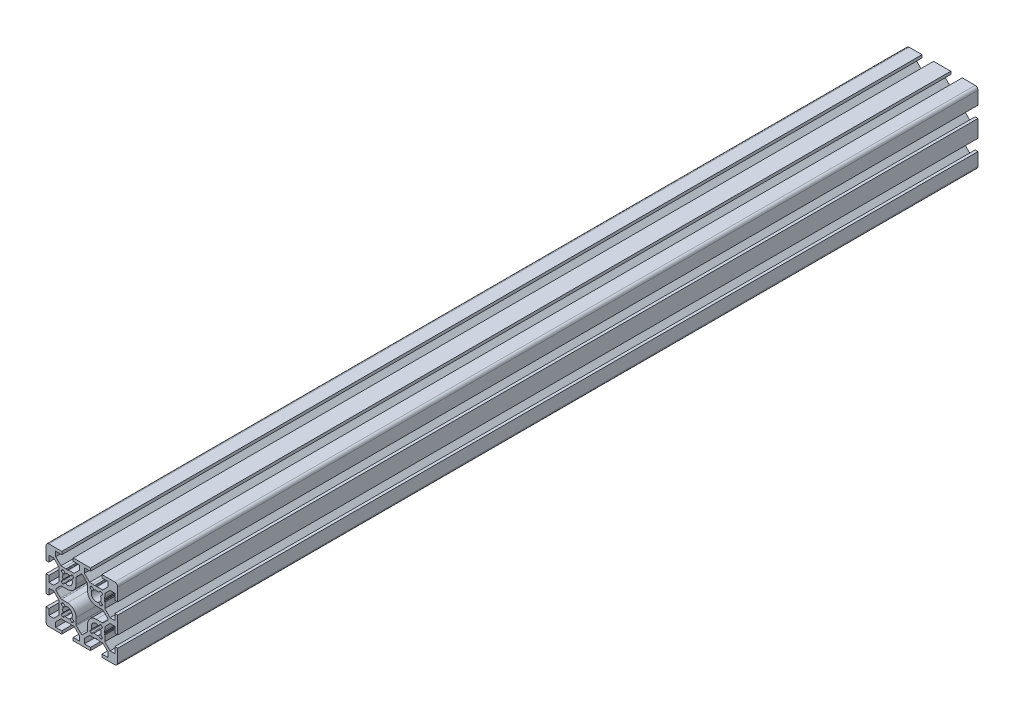
from build123d import *

# Parameters (mm, degrees)
BOSS_EXTRUDE1_DEPTH = 600
CUT_EXTRUDE1_DEPTH  = 602.040764009
CUT_EXTRUDE2_DEPTH  = 602.040764009
CUT_EXTRUDE3_DEPTH  = 602.040764009
CUT_EXTRUDE4_DEPTH  = 602.040764009


with BuildPart() as part:
    # Sketch1 → Boss-Extrude1 (new body)
    with BuildSketch(Plane.XY):
        with BuildLine():
            Line((-25, 23), (-25, 14))
            Line((-25, 14), (-23, 14))
            Line((-23, 14), (-23, 18.25))
            Line((-23, 18.25), (-19.664213562, 18.25))
            Line((-19.664213562, 18.25), (-16, 14.585786438))
            Line((-16, 14.585786438), (-16, 10.653589838))
            ThreePointArc((-16, 10.653589838), (-15.982962913, 10.524180316), (-15.933012702, 10.403589838))
            Line((-15.933012702, 10.403589838), (-15.7, 10))
            Line((-15.7, 10), (-15.933012702, 9.596410162))
            ThreePointArc((-15.933012702, 9.596410162), (-16, 9.346410162), (-15.933012702, 9.096410162))
            Line((-15.933012702, 9.096410162), (-15.750976592, 8.781114371))
            Line((-15.750976592, 8.781114371), (-16, 7.5))
            Line((-16, 7.5), (-16, 5.414213562))
            Line((-16, 5.414213562), (-19.664213562, 1.75))
            Line((-19.664213562, 1.75), (-23, 1.75))
            Line((-23, 1.75), (-23, 6))
            Line((-23, 6), (-25, 6))
            Line((-25, 6), (-25, -6))
            Line((-25, -6), (-23, -6))
            Line((-23, -6), (-23, -1.75))
            Line((-23, -1.75), (-19.664213562, -1.75))
            Line((-19.664213562, -1.75), (-16, -5.414213562))
            Line((-16, -5.414213562), (-16, -9.346410162))
            ThreePointArc((-16, -9.346410162), (-15.982962913, -9.475819684), (-15.933012702, -9.596410162))
            Line((-15.933012702, -9.596410162), (-15.7, -10))
            Line((-15.7, -10), (-15.933012702, -10.403589838))
            ThreePointArc((-15.933012702, -10.403589838), (-16, -10.653589838), (-15.933012702, -10.903589838))
            Line((-15.933012702, -10.903589838), (-15.750976592, -11.218885629))
            Line((-15.750976592, -11.218885629), (-16, -12.5))
            Line((-16, -12.5), (-16, -14.585786438))
            Line((-16, -14.585786438), (-19.664213562, -18.25))
            Line((-19.664213562, -18.25), (-23, -18.25))
            Line((-23, -18.25), (-23, -14))
            Line((-23, -14), (-25, -14))
            Line((-25, -14), (-25, -23))
            ThreePointArc((-25, -23), (-24.414213562, -24.414213562), (-23, -25))
            Line((-23, -25), (-14, -25))
            Line((-14, -25), (-14, -23))
            Line((-14, -23), (-18.25, -23))
            Line((-18.25, -23), (-18.25, -19.664213562))
            Line((-18.25, -19.664213562), (-14.585786438, -16))
            Line((-14.585786438, -16), (-10.653589838, -16))
            ThreePointArc((-10.653589838, -16), (-10.524180316, -15.982962913), (-10.403589838, -15.933012702))
            Line((-10.403589838, -15.933012702), (-10, -15.7))
            Line((-10, -15.7), (-9.596410162, -15.933012702))
            ThreePointArc((-9.596410162, -15.933012702), (-9.346410162, -16), (-9.096410162, -15.933012702))
            Line((-9.096410162, -15.933012702), (-8.781114371, -15.750976592))
            Line((-8.781114371, -15.750976592), (-7.5, -16))
            Line((-7.5, -16), (-5.414213562, -16))
            Line((-5.414213562, -16), (-1.75, -19.664213562))
            Line((-1.75, -19.664213562), (-1.75, -23))
            Line((-1.75, -23), (-6, -23))
            Line((-6, -23), (-6, -25))
            Line((-6, -25), (6, -25))
            Line((6, -25), (6, -23))
            Line((6, -23), (1.75, -23))
            Line((1.75, -23), (1.75, -19.664213562))
            Line((1.75, -19.664213562), (5.414213562, -16))
            Line((5.414213562, -16), (9.346410162, -16))
            ThreePointArc((9.346410162, -16), (9.475819684, -15.982962913), (9.596410162, -15.933012702))
            Line((9.596410162, -15.933012702), (10, -15.7))
            Line((10, -15.7), (10.403589838, -15.933012702))
            ThreePointArc((10.403589838, -15.933012702), (10.653589838, -16), (10.903589838, -15.933012702))
            Line((10.903589838, -15.933012702), (11.218885629, -15.750976592))
            Line((11.218885629, -15.750976592), (12.5, -16))
            Line((12.5, -16), (14.585786438, -16))
            Line((14.585786438, -16), (18.25, -19.664213562))
            Line((18.25, -19.664213562), (18.25, -23))
            Line((18.25, -23), (14, -23))
            Line((14, -23), (14, -25))
            Line((14, -25), (23, -25))
            ThreePointArc((23, -25), (24.414213562, -24.414213562), (25, -23))
            Line((25, -23), (25, -14))
            Line((25, -14), (23, -14))
            Line((23, -14), (23, -18.25))
            Line((23, -18.25), (19.664213562, -18.25))
            Line((19.664213562, -18.25), (16, -14.585786438))
            Line((16, -14.585786438), (16, -10.653589838))
            ThreePointArc((16, -10.653589838), (15.982962913, -10.524180316), (15.933012702, -10.403589838))
            Line((15.933012702, -10.403589838), (15.7, -10))
            Line((15.7, -10), (15.933012702, -9.596410162))
            ThreePointArc((15.933012702, -9.596410162), (16, -9.346410162), (15.933012702, -9.096410162))
            Line((15.933012702, -9.096410162), (15.750976592, -8.781114371))
            Line((15.750976592, -8.781114371), (16, -7.5))
            Line((16, -7.5), (16, -5.414213562))
            Line((16, -5.414213562), (19.664213562, -1.75))
            Line((19.664213562, -1.75), (23, -1.75))
            Line((23, -1.75), (23, -6))
            Line((23, -6), (25, -6))
            Line((25, -6), (25, 6))
            Line((25, 6), (23, 6))
            Line((23, 6), (23, 1.75))
            Line((23, 1.75), (19.664213562, 1.75))
            Line((19.664213562, 1.75), (16, 5.414213562))
            Line((16, 5.414213562), (16, 9.346410162))
            ThreePointArc((16, 9.346410162), (15.982962913, 9.475819684), (15.933012702, 9.596410162))
            Line((15.933012702, 9.596410162), (15.7, 10))
            Line((15.7, 10), (15.933012702, 10.403589838))
            ThreePointArc((15.933012702, 10.403589838), (16, 10.653589838), (15.933012702, 10.903589838))
            Line((15.933012702, 10.903589838), (15.750976592, 11.218885629))
            Line((15.750976592, 11.218885629), (16, 12.5))
            Line((16, 12.5), (16, 14.585786438))
            Line((16, 14.585786438), (19.664213562, 18.25))
            Line((19.664213562, 18.25), (23, 18.25))
            Line((23, 18.25), (23, 14))
            Line((23, 14), (25, 14))
            Line((25, 14), (25, 23))
            ThreePointArc((25, 23), (24.414213562, 24.414213562), (23, 25))
            Line((23, 25), (14, 25))
            Line((14, 25), (14, 23))
            Line((14, 23), (18.25, 23))
            Line((18.25, 23), (18.25, 19.664213562))
            Line((18.25, 19.664213562), (14.585786438, 16))
            Line((14.585786438, 16), (10.653589838, 16))
            ThreePointArc((10.653589838, 16), (10.524180316, 15.982962913), (10.403589838, 15.933012702))
            Line((10.403589838, 15.933012702), (10, 15.7))
            Line((10, 15.7), (9.596410162, 15.933012702))
            ThreePointArc((9.596410162, 15.933012702), (9.346410162, 16), (9.096410162, 15.933012702))
            Line((9.096410162, 15.933012702), (8.781114371, 15.750976592))
            Line((8.781114371, 15.750976592), (7.5, 16))
            Line((7.5, 16), (5.414213562, 16))
            Line((5.414213562, 16), (1.75, 19.664213562))
            Line((1.75, 19.664213562), (1.75, 23))
            Line((1.75, 23), (6, 23))
            Line((6, 23), (6, 25))
            Line((6, 25), (-6, 25))
            Line((-6, 25), (-6, 23))
            Line((-6, 23), (-1.75, 23))
            Line((-1.75, 23), (-1.75, 19.664213562))
            Line((-1.75, 19.664213562), (-5.414213562, 16))
            Line((-5.414213562, 16), (-9.346410162, 16))
            ThreePointArc((-9.346410162, 16), (-9.475819684, 15.982962913), (-9.596410162, 15.933012702))
            Line((-9.596410162, 15.933012702), (-10, 15.7))
            Line((-10, 15.7), (-10.403589838, 15.933012702))
            ThreePointArc((-10.403589838, 15.933012702), (-10.653589838, 16), (-10.903589838, 15.933012702))
            Line((-10.903589838, 15.933012702), (-11.218885629, 15.750976592))
            Line((-11.218885629, 15.750976592), (-12.5, 16))
            Line((-12.5, 16), (-14.585786438, 16))
            Line((-14.585786438, 16), (-18.25, 19.664213562))
            Line((-18.25, 19.664213562), (-18.25, 23))
            Line((-18.25, 23), (-14, 23))
            Line((-14, 23), (-14, 25))
            Line((-14, 25), (-23, 25))
            ThreePointArc((-23, 25), (-24.414213562, 24.414213562), (-25, 23))
        make_face()
        with BuildLine():
            Line((-17.878679656, -0.707106781), (-14.878679656, -3.707106781))
            ThreePointArc((-14.878679656, -3.707106781), (-14.554256308, -3.923879533), (-14.171572875, -4))
            Line((-14.171572875, -4), (-10, -4))
            ThreePointArc((-10, -4), (-5.757359313, -5.757359313), (-4, -10))
            Line((-4, -10), (-4, -14.171572875))
            ThreePointArc((-4, -14.171572875), (-3.923879533, -14.554256308), (-3.707106781, -14.878679656))
            Line((-3.707106781, -14.878679656), (-0.707106781, -17.878679656))
            ThreePointArc((-0.707106781, -17.878679656), (0, -18.171572875), (0.707106781, -17.878679656))
            Line((0.707106781, -17.878679656), (3.707106781, -14.878679656))
            ThreePointArc((3.707106781, -14.878679656), (3.923879533, -14.554256308), (4, -14.171572875))
            Line((4, -14.171572875), (4, -10))
            ThreePointArc((4, -10), (5.757359313, -5.757359313), (10, -4))
            Line((10, -4), (14.171572875, -4))
            ThreePointArc((14.171572875, -4), (14.554256308, -3.923879533), (14.878679656, -3.707106781))
            Line((14.878679656, -3.707106781), (17.878679656, -0.707106781))
            ThreePointArc((17.878679656, -0.707106781), (18.171572875, 0), (17.878679656, 0.707106781))
            Line((17.878679656, 0.707106781), (14.878679656, 3.707106781))
            ThreePointArc((14.878679656, 3.707106781), (14.554256308, 3.923879533), (14.171572875, 4))
            Line((14.171572875, 4), (10, 4))
            ThreePointArc((10, 4), (5.757359313, 5.757359313), (4, 10))
            Line((4, 10), (4, 14.171572875))
            ThreePointArc((4, 14.171572875), (3.923879533, 14.554256308), (3.707106781, 14.878679656))
            Line((3.707106781, 14.878679656), (0.707106781, 17.878679656))
            ThreePointArc((0.707106781, 17.878679656), (0, 18.171572875), (-0.707106781, 17.878679656))
            Line((-0.707106781, 17.878679656), (-3.707106781, 14.878679656))
            ThreePointArc((-3.707106781, 14.878679656), (-3.923879533, 14.554256308), (-4, 14.171572875))
            Line((-4, 14.171572875), (-4, 10))
            ThreePointArc((-4, 10), (-5.757359313, 5.757359313), (-10, 4))
            Line((-10, 4), (-14.171572875, 4))
            ThreePointArc((-14.171572875, 4), (-14.554256308, 3.923879533), (-14.878679656, 3.707106781))
            Line((-14.878679656, 3.707106781), (-17.878679656, 0.707106781))
            ThreePointArc((-17.878679656, 0.707106781), (-18.171572875, 0), (-17.878679656, -0.707106781))
        make_face(mode=Mode.SUBTRACT)
    extrude(amount=-BOSS_EXTRUDE1_DEPTH)

    # Sketch2 → Cut-Extrude1 (cut, through all)
    with BuildSketch(Plane.XY):
        with BuildLine():
            Line((-14.242640687, 12.828427125), (-13.205105981, 11.790892418))
            ThreePointArc((-13.205105981, 11.790892418), (-13.095045749, 11.583064884), (-13.120796199, 11.349307631))
            ThreePointArc((-13.120796199, 11.349307631), (-13.4, 10.000000021), (-13.120796216, 8.650692407))
            ThreePointArc((-13.120796216, 8.650692407), (-13.095045745, 8.416935137), (-13.205105981, 8.209107582))
            Line((-13.205105981, 8.209107582), (-14.242640687, 7.171572875))
            ThreePointArc((-14.242640687, 7.171572875), (-14.389087297, 6.818019485), (-14.242640687, 6.464466094))
            Line((-14.242640687, 6.464466094), (-13.535533906, 5.757359313))
            ThreePointArc((-13.535533906, 5.757359313), (-13.181980515, 5.610912703), (-12.828427125, 5.757359313))
            Line((-12.828427125, 5.757359313), (-11.790892418, 6.794894019))
            ThreePointArc((-11.790892418, 6.794894019), (-11.583064884, 6.904954251), (-11.349307631, 6.879203801))
            ThreePointArc((-11.349307631, 6.879203801), (-7.595836944, 7.595836944), (-6.879203801, 11.349307631))
            ThreePointArc((-6.879203801, 11.349307631), (-6.904954251, 11.583064884), (-6.794894019, 11.790892418))
            Line((-6.794894019, 11.790892418), (-5.757359313, 12.828427125))
            ThreePointArc((-5.757359313, 12.828427125), (-5.610912703, 13.181980515), (-5.757359313, 13.535533906))
            Line((-5.757359313, 13.535533906), (-6.464466094, 14.242640687))
            ThreePointArc((-6.464466094, 14.242640687), (-6.818019485, 14.389087297), (-7.171572875, 14.242640687))
            Line((-7.171572875, 14.242640687), (-8.209107582, 13.205105981))
            ThreePointArc((-8.209107582, 13.205105981), (-8.416935116, 13.095045749), (-8.650692369, 13.120796199))
            ThreePointArc((-8.650692369, 13.120796199), (-9.999999979, 13.4), (-11.349307593, 13.120796216))
            ThreePointArc((-11.349307593, 13.120796216), (-11.583064863, 13.095045745), (-11.790892418, 13.205105981))
            Line((-11.790892418, 13.205105981), (-12.828427125, 14.242640687))
            ThreePointArc((-12.828427125, 14.242640687), (-13.181980515, 14.389087297), (-13.535533906, 14.242640687))
            Line((-13.535533906, 14.242640687), (-14.242640687, 13.535533906))
            ThreePointArc((-14.242640687, 13.535533906), (-14.389087297, 13.181980515), (-14.242640687, 12.828427125))
        make_face()
    extrude(amount=-CUT_EXTRUDE1_DEPTH, mode=Mode.SUBTRACT)

    # Sketch3 → Cut-Extrude2 (cut, through all)
    with BuildSketch(Plane.XY):
        with BuildLine():
            Line((-12.828427125, -14.242640687), (-11.790892418, -13.205105981))
            ThreePointArc((-11.790892418, -13.205105981), (-11.583064884, -13.095045749), (-11.349307631, -13.120796199))
            ThreePointArc((-11.349307631, -13.120796199), (-10.000000021, -13.4), (-8.650692407, -13.120796216))
            ThreePointArc((-8.650692407, -13.120796216), (-8.416935137, -13.095045745), (-8.209107582, -13.205105981))
            Line((-8.209107582, -13.205105981), (-7.171572875, -14.242640687))
            ThreePointArc((-7.171572875, -14.242640687), (-6.818019485, -14.389087297), (-6.464466094, -14.242640687))
            Line((-6.464466094, -14.242640687), (-5.757359313, -13.535533906))
            ThreePointArc((-5.757359313, -13.535533906), (-5.610912703, -13.181980515), (-5.757359313, -12.828427125))
            Line((-5.757359313, -12.828427125), (-6.794894019, -11.790892418))
            ThreePointArc((-6.794894019, -11.790892418), (-6.904954251, -11.583064884), (-6.879203801, -11.349307631))
            ThreePointArc((-6.879203801, -11.349307631), (-7.595836944, -7.595836944), (-11.349307631, -6.879203801))
            ThreePointArc((-11.349307631, -6.879203801), (-11.583064884, -6.904954251), (-11.790892418, -6.794894019))
            Line((-11.790892418, -6.794894019), (-12.828427125, -5.757359313))
            ThreePointArc((-12.828427125, -5.757359313), (-13.181980515, -5.610912703), (-13.535533906, -5.757359313))
            Line((-13.535533906, -5.757359313), (-14.242640687, -6.464466094))
            ThreePointArc((-14.242640687, -6.464466094), (-14.389087297, -6.818019485), (-14.242640687, -7.171572875))
            Line((-14.242640687, -7.171572875), (-13.205105981, -8.209107582))
            ThreePointArc((-13.205105981, -8.209107582), (-13.095045749, -8.416935116), (-13.120796199, -8.650692369))
            ThreePointArc((-13.120796199, -8.650692369), (-13.4, -9.999999979), (-13.120796216, -11.349307593))
            ThreePointArc((-13.120796216, -11.349307593), (-13.095045745, -11.583064863), (-13.205105981, -11.790892418))
            Line((-13.205105981, -11.790892418), (-14.242640687, -12.828427125))
            ThreePointArc((-14.242640687, -12.828427125), (-14.389087297, -13.181980515), (-14.242640687, -13.535533906))
            Line((-14.242640687, -13.535533906), (-13.535533906, -14.242640687))
            ThreePointArc((-13.535533906, -14.242640687), (-13.181980515, -14.389087297), (-12.828427125, -14.242640687))
        make_face()
    extrude(amount=-CUT_EXTRUDE2_DEPTH, mode=Mode.SUBTRACT)

    # Sketch4 → Cut-Extrude3 (cut, through all)
    with BuildSketch(Plane.XY):
        with BuildLine():
            Line((14.242640687, -12.828427125), (13.205105981, -11.790892418))
            ThreePointArc((13.205105981, -11.790892418), (13.095045749, -11.583064884), (13.120796199, -11.349307631))
            ThreePointArc((13.120796199, -11.349307631), (13.4, -10.000000021), (13.120796216, -8.650692407))
            ThreePointArc((13.120796216, -8.650692407), (13.095045745, -8.416935137), (13.205105981, -8.209107582))
            Line((13.205105981, -8.209107582), (14.242640687, -7.171572875))
            ThreePointArc((14.242640687, -7.171572875), (14.389087297, -6.818019485), (14.242640687, -6.464466094))
            Line((14.242640687, -6.464466094), (13.535533906, -5.757359313))
            ThreePointArc((13.535533906, -5.757359313), (13.181980515, -5.610912703), (12.828427125, -5.757359313))
            Line((12.828427125, -5.757359313), (11.790892418, -6.794894019))
            ThreePointArc((11.790892418, -6.794894019), (11.583064884, -6.904954251), (11.349307631, -6.879203801))
            ThreePointArc((11.349307631, -6.879203801), (7.595836944, -7.595836944), (6.879203801, -11.349307631))
            ThreePointArc((6.879203801, -11.349307631), (6.904954251, -11.583064884), (6.794894019, -11.790892418))
            Line((6.794894019, -11.790892418), (5.757359313, -12.828427125))
            ThreePointArc((5.757359313, -12.828427125), (5.610912703, -13.181980515), (5.757359313, -13.535533906))
            Line((5.757359313, -13.535533906), (6.464466094, -14.242640687))
            ThreePointArc((6.464466094, -14.242640687), (6.818019485, -14.389087297), (7.171572875, -14.242640687))
            Line((7.171572875, -14.242640687), (8.209107582, -13.205105981))
            ThreePointArc((8.209107582, -13.205105981), (8.416935116, -13.095045749), (8.650692369, -13.120796199))
            ThreePointArc((8.650692369, -13.120796199), (9.999999979, -13.4), (11.349307593, -13.120796216))
            ThreePointArc((11.349307593, -13.120796216), (11.583064863, -13.095045745), (11.790892418, -13.205105981))
            Line((11.790892418, -13.205105981), (12.828427125, -14.242640687))
            ThreePointArc((12.828427125, -14.242640687), (13.181980515, -14.389087297), (13.535533906, -14.242640687))
            Line((13.535533906, -14.242640687), (14.242640687, -13.535533906))
            ThreePointArc((14.242640687, -13.535533906), (14.389087297, -13.181980515), (14.242640687, -12.828427125))
        make_face()
    extrude(amount=-CUT_EXTRUDE3_DEPTH, mode=Mode.SUBTRACT)

    # Sketch5 → Cut-Extrude4 (cut, through all)
    with BuildSketch(Plane.XY):
        with BuildLine():
            Line((12.828427125, 14.242640687), (11.790892418, 13.205105981))
            ThreePointArc((11.790892418, 13.205105981), (11.583064884, 13.095045749), (11.349307631, 13.120796199))
            ThreePointArc((11.349307631, 13.120796199), (10.000000021, 13.4), (8.650692407, 13.120796216))
            ThreePointArc((8.650692407, 13.120796216), (8.416935137, 13.095045745), (8.209107582, 13.205105981))
            Line((8.209107582, 13.205105981), (7.171572875, 14.242640687))
            ThreePointArc((7.171572875, 14.242640687), (6.818019485, 14.389087297), (6.464466094, 14.242640687))
            Line((6.464466094, 14.242640687), (5.757359313, 13.535533906))
            ThreePointArc((5.757359313, 13.535533906), (5.610912703, 13.181980515), (5.757359313, 12.828427125))
            Line((5.757359313, 12.828427125), (6.794894019, 11.790892418))
            ThreePointArc((6.794894019, 11.790892418), (6.904954251, 11.583064884), (6.879203801, 11.349307631))
            ThreePointArc((6.879203801, 11.349307631), (7.595836944, 7.595836944), (11.349307631, 6.879203801))
            ThreePointArc((11.349307631, 6.879203801), (11.583064884, 6.904954251), (11.790892418, 6.794894019))
            Line((11.790892418, 6.794894019), (12.828427125, 5.757359313))
            ThreePointArc((12.828427125, 5.757359313), (13.181980515, 5.610912703), (13.535533906, 5.757359313))
            Line((13.535533906, 5.757359313), (14.242640687, 6.464466094))
            ThreePointArc((14.242640687, 6.464466094), (14.389087297, 6.818019485), (14.242640687, 7.171572875))
            Line((14.242640687, 7.171572875), (13.205105981, 8.209107582))
            ThreePointArc((13.205105981, 8.209107582), (13.095045749, 8.416935116), (13.120796199, 8.650692369))
            ThreePointArc((13.120796199, 8.650692369), (13.4, 9.999999979), (13.120796216, 11.349307593))
            ThreePointArc((13.120796216, 11.349307593), (13.095045745, 11.583064863), (13.205105981, 11.790892418))
            Line((13.205105981, 11.790892418), (14.242640687, 12.828427125))
            ThreePointArc((14.242640687, 12.828427125), (14.389087297, 13.181980515), (14.242640687, 13.535533906))
            Line((14.242640687, 13.535533906), (13.535533906, 14.242640687))
            ThreePointArc((13.535533906, 14.242640687), (13.181980515, 14.389087297), (12.828427125, 14.242640687))
        make_face()
    extrude(amount=-CUT_EXTRUDE4_DEPTH, mode=Mode.SUBTRACT)


solid = part.part
